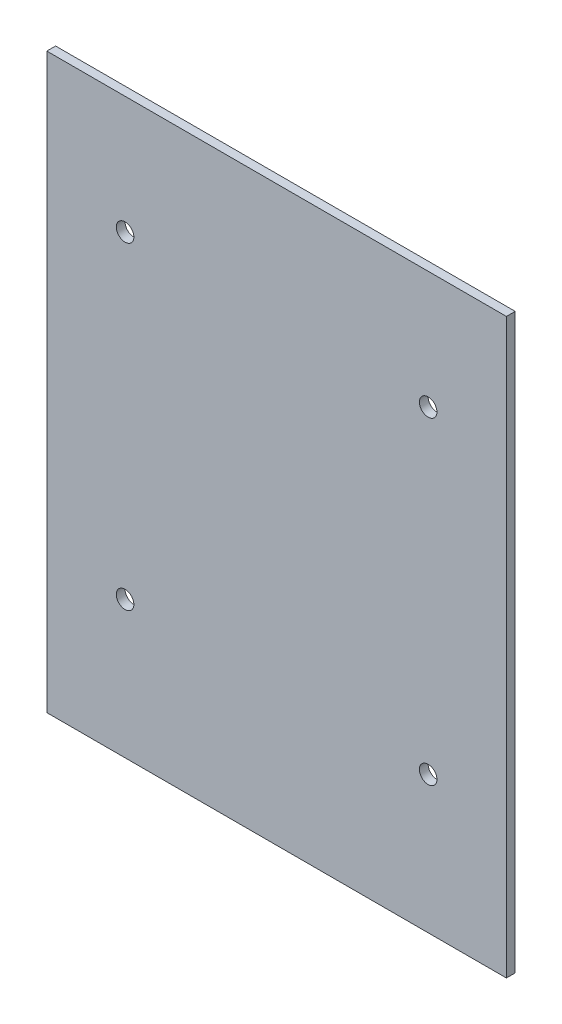
from build123d import *

# Parameters (mm, degrees)
SKETCH1_W           = 166.124
SKETCH1_H           = 207.09
SKETCH1_R           = 3.175
BOSS_EXTRUDE1_DEPTH = 3.175


with BuildPart() as part:
    # Sketch1 → Boss-Extrude1 (new body)
    with BuildSketch(Plane.XY):
        with Locations((83.062, -103.545)):
            Rectangle(SKETCH1_W, SKETCH1_H)
        with Locations((28.287, -42.5)):
            Circle(SKETCH1_R, mode=Mode.SUBTRACT)
        with Locations(Location((137.837, -42.5, 0), (0, 0, 180))):
            Circle(SKETCH1_R, mode=Mode.SUBTRACT)
        with Locations(Location((28.287, -157.5, 0), (0, 0, 180))):
            Circle(SKETCH1_R, mode=Mode.SUBTRACT)
        with Locations((137.837, -157.5)):
            Circle(SKETCH1_R, mode=Mode.SUBTRACT)
    extrude(amount=BOSS_EXTRUDE1_DEPTH)


solid = part.part
